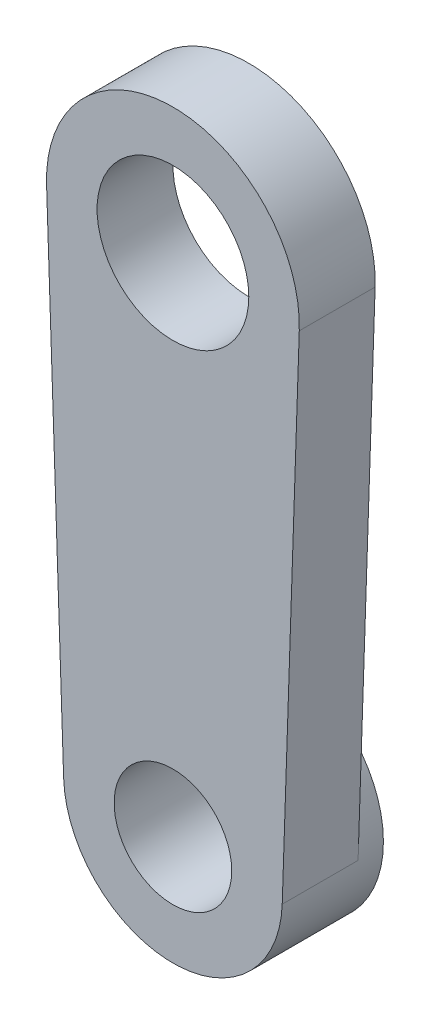
from build123d import *

# Parameters (mm, degrees)
SKETCH1_R           = 2.325
SKETCH1_R_2         = 3
BOSS_EXTRUDE1_DEPTH = 3
BOSS_EXTRUDE2_START = -1
SKETCH1_3_R         = 4.325
SKETCH1_3_R_2       = 2.325
BOSS_EXTRUDE2_DEPTH = 1


with BuildPart() as part:
    # Sketch1 → Boss-Extrude1 (new body)
    with BuildSketch(Plane.XY):
        with BuildLine():
            Line((-4.997151532, 19.83125), (-4.322536076, -0.14596875))
            ThreePointArc((-4.322536076, -0.14596875), (0, -4.325), (4.322536076, -0.14596875))
            Line((4.322536076, -0.14596875), (4.997151532, 19.83125))
            ThreePointArc((4.997151532, 19.83125), (0, 25), (-4.997151532, 19.83125))
        make_face()
        Circle(SKETCH1_R, mode=Mode.SUBTRACT)
        with Locations((0, 20)):
            Circle(SKETCH1_R_2, mode=Mode.SUBTRACT)
    extrude(amount=BOSS_EXTRUDE1_DEPTH)

    # Sketch1<3> → Boss-Extrude2 (add)
    with BuildSketch(Plane.XY.offset(BOSS_EXTRUDE2_START)):
        with Locations(Location((0, 0, 0), (0, 0, 181.934099854))):
            Circle(SKETCH1_3_R)
        Circle(SKETCH1_3_R_2, mode=Mode.SUBTRACT)
    extrude(amount=BOSS_EXTRUDE2_DEPTH)


solid = part.part
